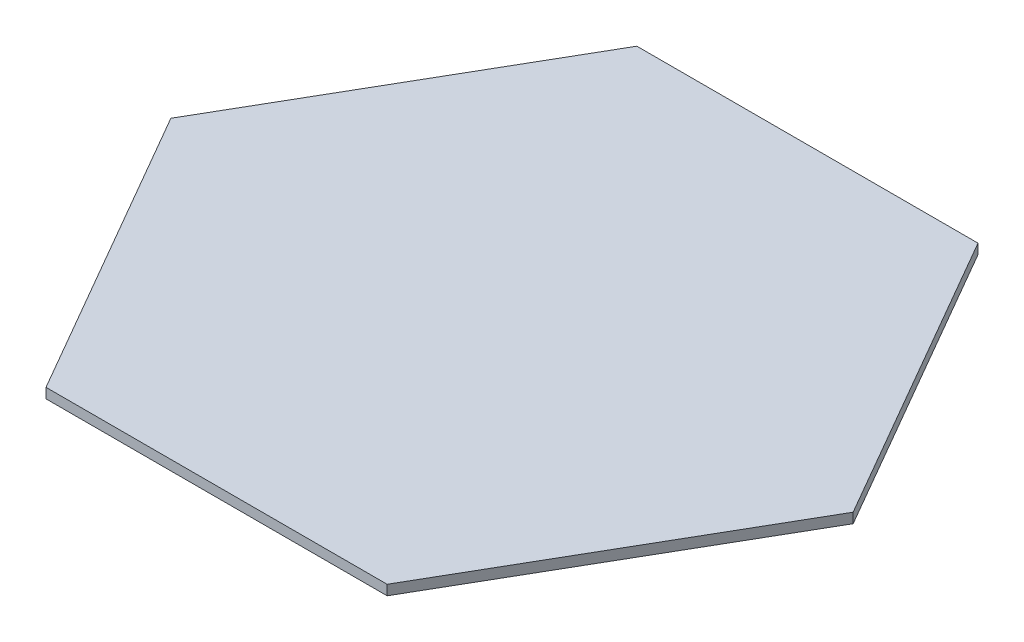
from build123d import *

# Parameters (mm, degrees)
BOSS_EXTRUDE1_DEPTH = 5


with BuildPart() as part:
    # Sketch1 → Boss-Extrude1 (new body)
    with BuildSketch(Plane(origin=(0, 0, 0), x_dir=(1, 0, 0), z_dir=(0, 1, 0))):
        Polygon((85.25, -147.657331345), (170.5, 0), (85.25, 147.657331345), (-85.25, 147.657331345), (-170.5, 0), (-85.25, -147.657331345), align=None)
    extrude(amount=BOSS_EXTRUDE1_DEPTH)


solid = part.part
